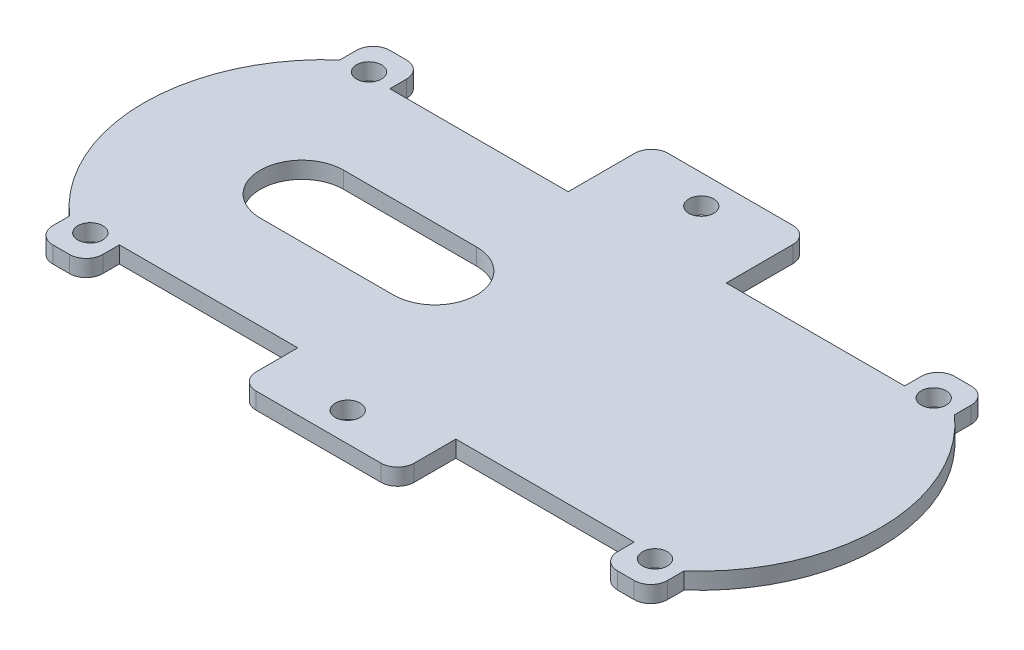
from build123d import *

# Parameters (mm, degrees)
SKETCH3_R           = 1.5
BOSS_EXTRUDE3_DEPTH = 2
CUT_EXTRUDE1_DEPTH  = 3
FILLET1_R           = 2


with BuildPart() as part:
    # Sketch3 → Boss-Extrude3 (new body)
    with BuildSketch(Plane(origin=(0, 0, 0), x_dir=(1, 0, 0), z_dir=(0, 1, 0))):
        with BuildLine():
            Line((-9.26926183, -10.650603484), (-9.26926183, -17.650603484))
            Line((-9.26926183, -17.650603484), (9.73073817, -17.650603484))
            Line((9.73073817, -17.650603484), (9.73073817, -10.650603484))
            Line((9.73073817, -10.650603484), (31.167436549, -10.650603484))
            Line((31.167436549, -10.650603484), (31.167436549, -14.650603484))
            Line((31.167436549, -14.650603484), (37.167436549, -14.650603484))
            Line((37.167436549, -14.650603484), (37.167436549, -10.650603484))
            ThreePointArc((37.167436549, -10.650603484), (44.48073817, 5.599396516), (37.167436549, 21.849396516))
            Line((37.167436549, 21.849396516), (37.167436549, 25.849396516))
            Line((37.167436549, 25.849396516), (31.167436549, 25.849396516))
            Line((31.167436549, 25.849396516), (31.167436549, 21.849396516))
            Line((31.167436549, 21.849396516), (9.73073817, 21.849396516))
            Line((9.73073817, 21.849396516), (9.73073817, 31.849396516))
            Line((9.73073817, 31.849396516), (-9.26926183, 31.849396516))
            Line((-9.26926183, 31.849396516), (-9.26926183, 21.849396516))
            Line((-9.26926183, 21.849396516), (-30.705960209, 21.849396516))
            Line((-30.705960209, 21.849396516), (-30.705960209, 25.849396516))
            Line((-30.705960209, 25.849396516), (-36.705960209, 25.849396516))
            Line((-36.705960209, 25.849396516), (-36.705960209, 21.849396516))
            ThreePointArc((-36.705960209, 21.849396516), (-44.01926183, 5.599396516), (-36.705960209, -10.650603484))
            Line((-36.705960209, -10.650603484), (-36.705960209, -14.650603484))
            Line((-36.705960209, -14.650603484), (-30.705960209, -14.650603484))
            Line((-30.705960209, -14.650603484), (-30.705960209, -10.650603484))
            Line((-30.705960209, -10.650603484), (-9.26926183, -10.650603484))
        make_face()
        with Locations(Location((-33.705960209, 22.349396516, 0), (0, 0, 270))):
            Circle(SKETCH3_R, mode=Mode.SUBTRACT)
        with Locations(Location((-33.705960209, -11.150603484, 0), (0, 0, 270))):
            Circle(SKETCH3_R, mode=Mode.SUBTRACT)
        with Locations(Location((34.167436549, -11.150603484, 0), (0, 0, 270))):
            Circle(SKETCH3_R, mode=Mode.SUBTRACT)
        with Locations(Location((34.167436549, 22.349396516, 0), (0, 0, 270))):
            Circle(SKETCH3_R, mode=Mode.SUBTRACT)
        with Locations(Location((0.23073817, -14.150603484, 0), (0, 0, 270))):
            Circle(SKETCH3_R, mode=Mode.SUBTRACT)
        with Locations(Location((0.23073817, 28.349396516, 0), (0, 0, 270))):
            Circle(SKETCH3_R, mode=Mode.SUBTRACT)
    extrude(amount=BOSS_EXTRUDE3_DEPTH)

    # Sketch4 → Cut-Extrude1 (cut)
    with BuildSketch(Plane(origin=(0, 2, 0), x_dir=(1, 0, 0), z_dir=(0, 1, 0))):
        with BuildLine():
            Line((-25.01926183, 10.599396516), (-9.01926183, 10.599396516))
            ThreePointArc((-9.01926183, 10.599396516), (-4.01926183, 5.599396516), (-9.01926183, 0.599396516))
            Line((-9.01926183, 0.599396516), (-25.01926183, 0.599396516))
            ThreePointArc((-25.01926183, 0.599396516), (-30.01926183, 5.599396516), (-25.01926183, 10.599396516))
        make_face()
    extrude(amount=-CUT_EXTRUDE1_DEPTH, mode=Mode.SUBTRACT)

    # Fillet1
    fillet1_edges = [part.edges().sort_by_distance(p)[0] for p in [
        (-30.705960209, 1, 14.650603484),
        (-36.705960209, 1, 14.650603484),
        (-36.705960209, 1, -25.849396516),
        (-30.705960209, 1, -25.849396516),
        (-9.26926183, 1, -31.849396516),
        (9.73073817, 1, -31.849396516),
        (31.167436549, 1, -25.849396516),
        (37.167436549, 1, -25.849396516),
        (37.167436549, 1, 14.650603484),
        (31.167436549, 1, 14.650603484),
        (9.73073817, 1, 17.650603484),
        (-9.26926183, 1, 17.650603484),
    ]]
    fillet(fillet1_edges, radius=FILLET1_R)


solid = part.part
